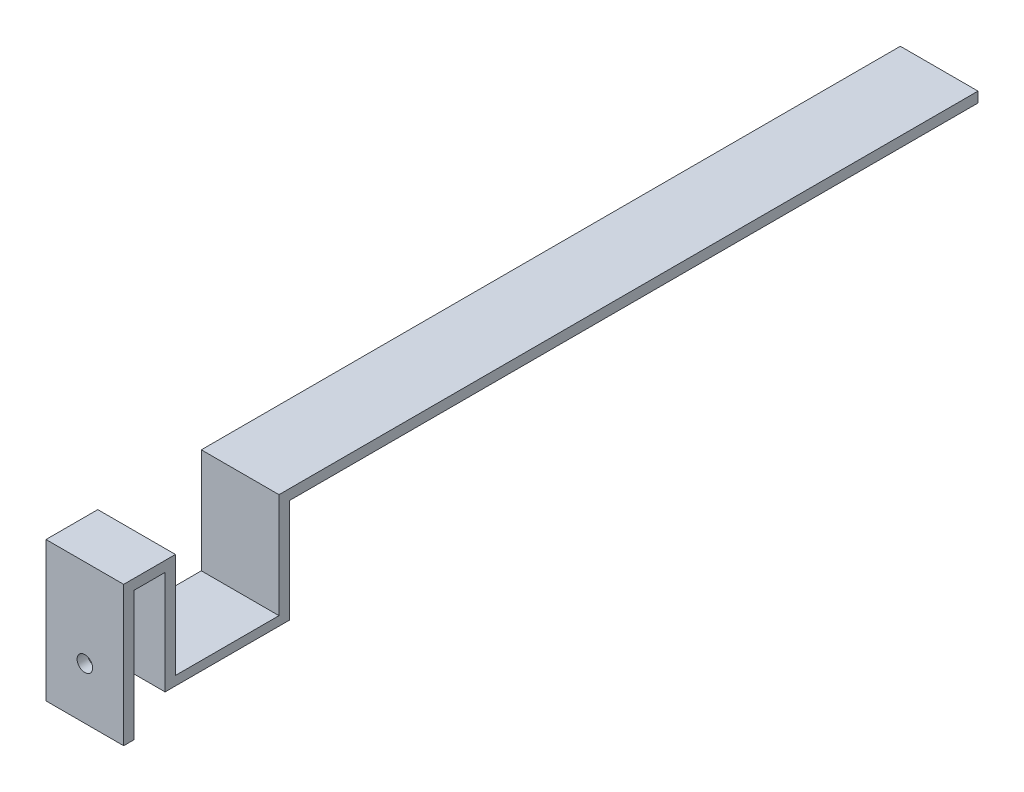
from build123d import *

# Parameters (mm, degrees)
BOSS_EXTRUDE1_DEPTH = 15
SKETCH3_R           = 1.5
CUT_EXTRUDE1_DEPTH  = 2


with BuildPart() as part:
    # Sketch2 → Boss-Extrude1 (new body)
    with BuildSketch(Plane(origin=(0, 0, 0), x_dir=(0, 0, -1), z_dir=(1, 0, 0))):
        Polygon((0, 27), (10, 27), (10, 6.760833057), (30, 6.760833057), (30, 27), (165, 27), (165, 25), (32, 25), (32, 5), (8, 5), (8, 25), (2, 25), (2, 0), (0, 0), align=None)
    extrude(amount=BOSS_EXTRUDE1_DEPTH)

    # Sketch3 → Cut-Extrude1 (cut)
    with BuildSketch(Plane.XY):
        with Locations((7.5, 10)):
            Circle(SKETCH3_R)
    extrude(amount=-CUT_EXTRUDE1_DEPTH, mode=Mode.SUBTRACT)


solid = part.part
